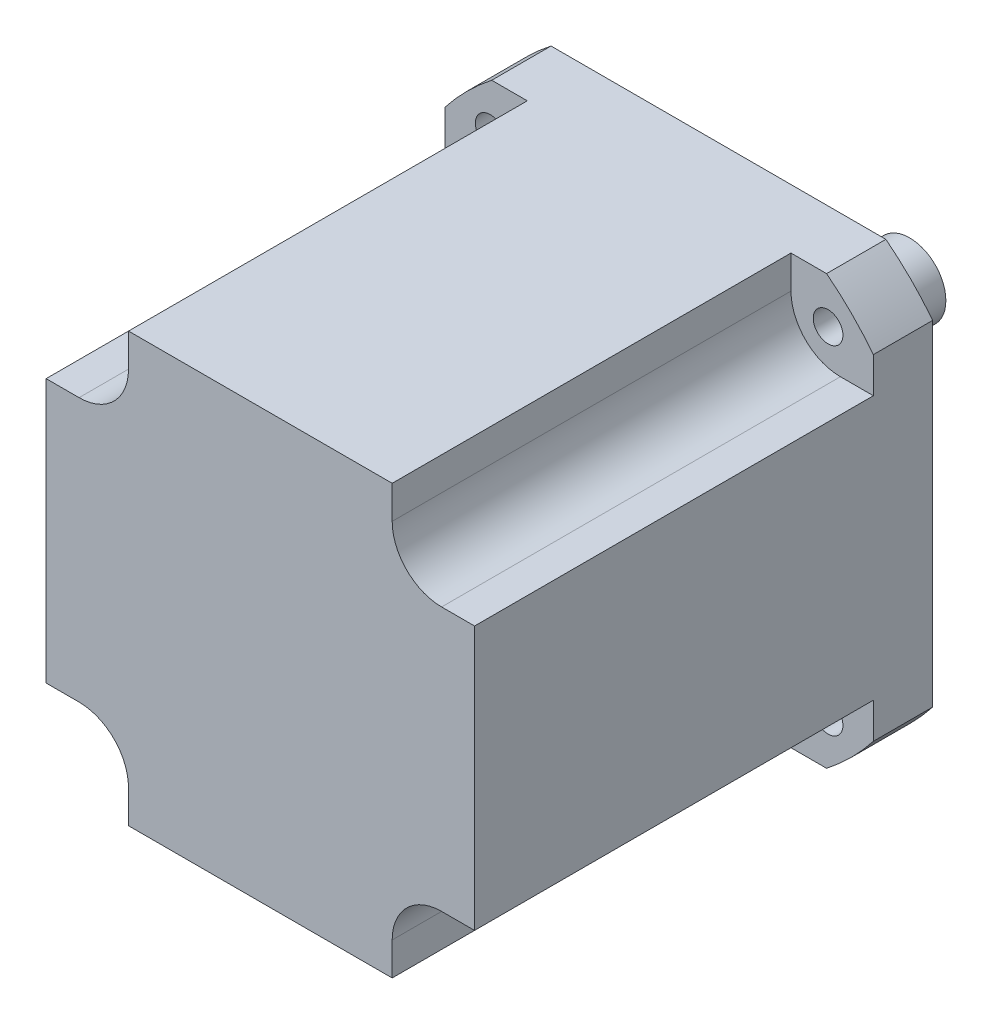
from build123d import *

# Parameters (mm, degrees)
SKETCH_1_W          = 130
SKETCH_1_H          = 130
EXTRUDE_1_DEPTH     = 139
SKETCH_2_R          = 55
EXTRUDE_2_DEPTH     = 6
SKETCH_3_R          = 11
EXTRUDE_3_DEPTH     = 52
SKETCH_5_R          = 4.5
CUT_EXTRUDE_2_DEPTH = 137
CUT_EXTRUDE_5_DEPTH = 221.093162093
SKETCH_10_OUTSIDE_W = 185.892
SKETCH_10_OUTSIDE_H = 185.892
SKETCH_10_OUTSIDE_R = 82.5
CUT_EXTRUDE_6_DEPTH = 231.479934051


with BuildPart() as part:
    # 草图1 → 拉伸1 (new body)
    with BuildSketch(Plane.XY):
        with Locations((65, -65)):
            Rectangle(SKETCH_1_W, SKETCH_1_H)
    extrude(amount=EXTRUDE_1_DEPTH)

    # 草图2 → 拉伸2 (add)
    with BuildSketch(Plane(origin=(0, 0, 0), x_dir=(-1, 0, 0), z_dir=(0, 0, -1))):
        with Locations(Location((-65, -65, 0), (0, 0, 180))):
            Circle(SKETCH_2_R)
    extrude(amount=EXTRUDE_2_DEPTH)

    # 草图3 → 拉伸3 (add)
    with BuildSketch(Plane(origin=(0, 0, -6), x_dir=(-1, 0, 0), z_dir=(0, 0, -1))):
        with Locations(Location((-65, -65, 0), (0, 0, 180))):
            Circle(SKETCH_3_R)
    extrude(amount=EXTRUDE_3_DEPTH)

    # 草图5 → 切除-拉伸2 (cut)
    with BuildSketch(Plane(origin=(0, 0, 0), x_dir=(-1, 0, 0), z_dir=(0, 0, -1))):
        with Locations((-13.734758364, -13.734758364)):
            Circle(SKETCH_5_R)
        with Locations((-13.734758364, -116.265241636)):
            Circle(SKETCH_5_R)
        with Locations((-116.265241636, -116.265241636)):
            Circle(SKETCH_5_R)
        with Locations((-116.265241636, -13.734758364)):
            Circle(SKETCH_5_R)
    extrude(amount=-CUT_EXTRUDE_2_DEPTH, mode=Mode.SUBTRACT)

    # 草图7 → 切除-拉伸5 (cut, through all)
    with BuildSketch(Plane(origin=(0, 0, 18), x_dir=(-1, 0, 0), z_dir=(0, 0, -1))):
        with BuildLine():
            Line((-130, 0), (-105, 0))
            Line((-105, 0), (-105, -10))
            ThreePointArc((-105, -10), (-109.393398282, -20.606601718), (-120, -25))
            Line((-120, -25), (-130, -25))
            Line((-130, -25), (-130, 0))
        make_face()
        with BuildLine():
            Line((0, 0), (0, -25))
            Line((0, -25), (-10, -25))
            ThreePointArc((-10, -25), (-20.606601718, -20.606601718), (-25, -10))
            Line((-25, -10), (-25, 0))
            Line((-25, 0), (0, 0))
        make_face()
        with BuildLine():
            Line((0, -130), (-25, -130))
            Line((-25, -130), (-25, -120))
            ThreePointArc((-25, -120), (-20.606601718, -109.393398282), (-10, -105))
            Line((-10, -105), (0, -105))
            Line((0, -105), (0, -130))
        make_face()
        with BuildLine():
            Line((-130, -130), (-130, -105))
            Line((-130, -105), (-120, -105))
            ThreePointArc((-120, -105), (-109.393398282, -109.393398282), (-105, -120))
            Line((-105, -120), (-105, -130))
            Line((-105, -130), (-130, -130))
        make_face()
    extrude(amount=-CUT_EXTRUDE_5_DEPTH, mode=Mode.SUBTRACT)

    # 草图10 outside → 切除-拉伸6 (cut, through all)
    with BuildSketch(Plane(origin=(0, 0, 0), x_dir=(-1, 0, 0), z_dir=(0, 0, -1))):
        with Locations((-65, -65)):
            Rectangle(SKETCH_10_OUTSIDE_W, SKETCH_10_OUTSIDE_H)
        with Locations((-65, -65)):
            Circle(SKETCH_10_OUTSIDE_R, mode=Mode.SUBTRACT)
    extrude(amount=-CUT_EXTRUDE_6_DEPTH, mode=Mode.SUBTRACT)


solid = part.part
